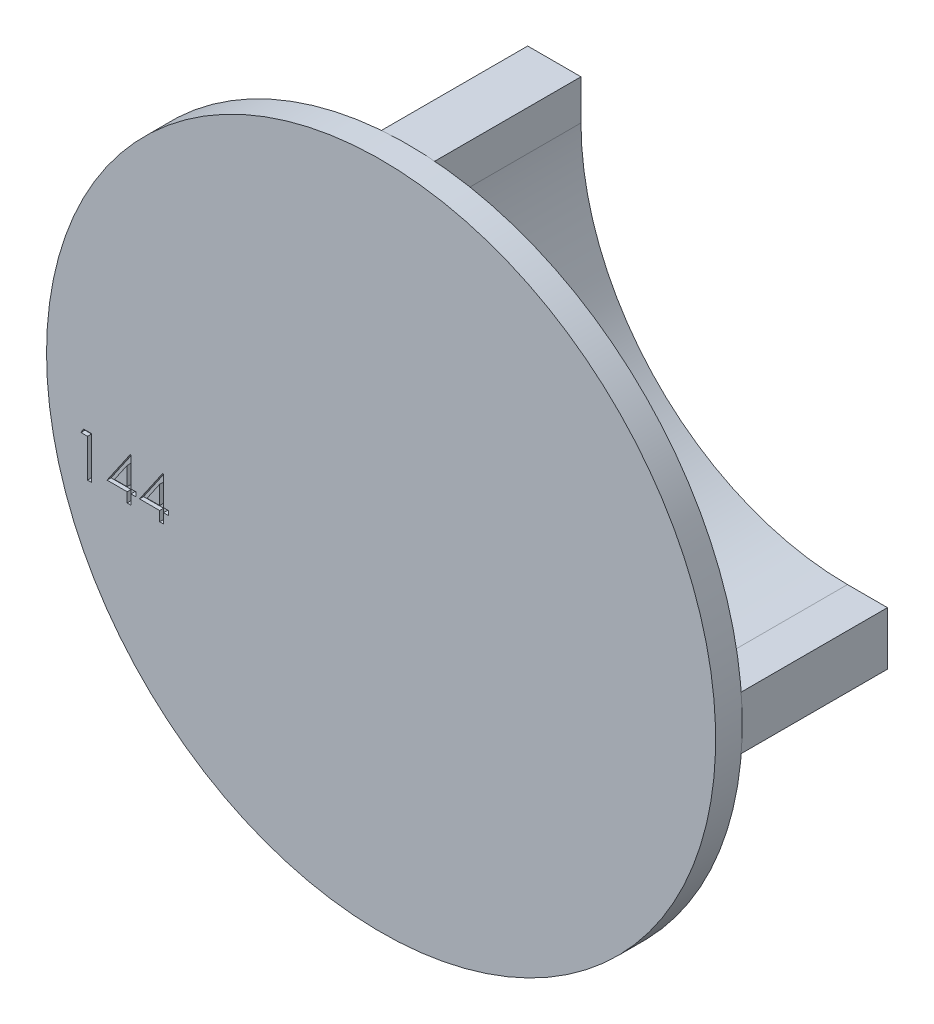
from build123d import *

# Parameters (mm, degrees)
BOSS_EXTRUDE1_START = 2
BOSS_EXTRUDE1_DEPTH = 13
SKETCH7_R           = 25.106657787
BOSS_EXTRUDE3_DEPTH = 2
SKETCH8_R           = 5
CUT_EXTRUDE2_DEPTH  = 4
CUT_EXTRUDE3_DEPTH  = 0.3


with BuildPart() as part:
    # Sketch4 → Boss-Extrude1 (new body)
    with BuildSketch(Plane.XY.offset(BOSS_EXTRUDE1_START)):
        with BuildLine():
            Line((-25, 2), (-25, 0))
            Line((-25, 0), (25, 0))
            Line((25, 0), (25, 2))
            Line((25, 2), (22, 2))
            ThreePointArc((22, 2), (7.857864376, 7.857864376), (2, 22))
            Line((2, 22), (2, 25))
            Line((2, 25), (-2, 25))
            Line((-2, 25), (-2, 22))
            ThreePointArc((-2, 22), (-7.857864376, 7.857864376), (-22, 2))
            Line((-22, 2), (-25, 2))
        make_face()
        with BuildLine():
            Line((25, 0), (-25, 0))
            Line((-25, 0), (-25, -2))
            Line((-25, -2), (-22, -2))
            ThreePointArc((-22, -2), (-7.857864376, -7.857864376), (-2, -22))
            Line((-2, -22), (-2, -25))
            Line((-2, -25), (2, -25))
            Line((2, -25), (2, -22))
            ThreePointArc((2, -22), (7.857864376, -7.857864376), (22, -2))
            Line((22, -2), (25, -2))
            Line((25, -2), (25, 0))
        make_face()
    extrude(amount=BOSS_EXTRUDE1_DEPTH)

    # Sketch7 → Boss-Extrude3 (add)
    with BuildSketch(Plane(origin=(0, 0, 15), x_dir=(-1, 0, 0), z_dir=(0, 0, -1))):
        Circle(SKETCH7_R)
    extrude(amount=BOSS_EXTRUDE3_DEPTH)

    # Sketch8 → Cut-Extrude2 (cut)
    with BuildSketch(Plane.XY):
        Circle(SKETCH8_R)
    extrude(amount=CUT_EXTRUDE2_DEPTH, mode=Mode.SUBTRACT)

    # Sketch11 → Cut-Extrude3 (cut)
    # profile 1 of 3: a face of its own
    with BuildSketch(Plane.XY.offset(15)):
        Polygon((-22.334208893, -3.554058613), (-21.747164623, -3.554058613), (-21.747164623, -6.729058613), (-22.03210052, -6.729058613), (-22.03210052, -3.879699638), (-22.520562059, -3.879699638), align=None)
    # profile 2 of 3: a face of its own
    with BuildSketch(Plane.XY.offset(15)):
        Polygon((-18.833567868, -3.472648356), (-18.775690264, -3.472648356), (-18.775690264, -5.670725279), (-18.40934411, -5.670725279), (-18.40934411, -5.996366305), (-18.775690264, -5.996366305), (-18.775690264, -6.729058613), (-19.060626161, -6.729058613), (-19.060626161, -5.996366305), (-20.566715905, -5.996366305), align=None)
        Polygon((-19.060626161, -5.670725279), (-19.060626161, -4.291839062), (-20.007020392, -5.670725279), align=None, mode=Mode.SUBTRACT)
    # profile 3 of 3: a face of its own
    with BuildSketch(Plane.XY.offset(15)):
        Polygon((-16.391260175, -3.472648356), (-16.333382571, -3.472648356), (-16.333382571, -5.670725279), (-15.967036417, -5.670725279), (-15.967036417, -5.996366305), (-16.333382571, -5.996366305), (-16.333382571, -6.729058613), (-16.618318469, -6.729058613), (-16.618318469, -5.996366305), (-18.124408212, -5.996366305), align=None)
        Polygon((-16.618318469, -5.670725279), (-16.618318469, -4.291839062), (-17.5647127, -5.670725279), align=None, mode=Mode.SUBTRACT)
    extrude(amount=-CUT_EXTRUDE3_DEPTH, mode=Mode.SUBTRACT)


solid = part.part
